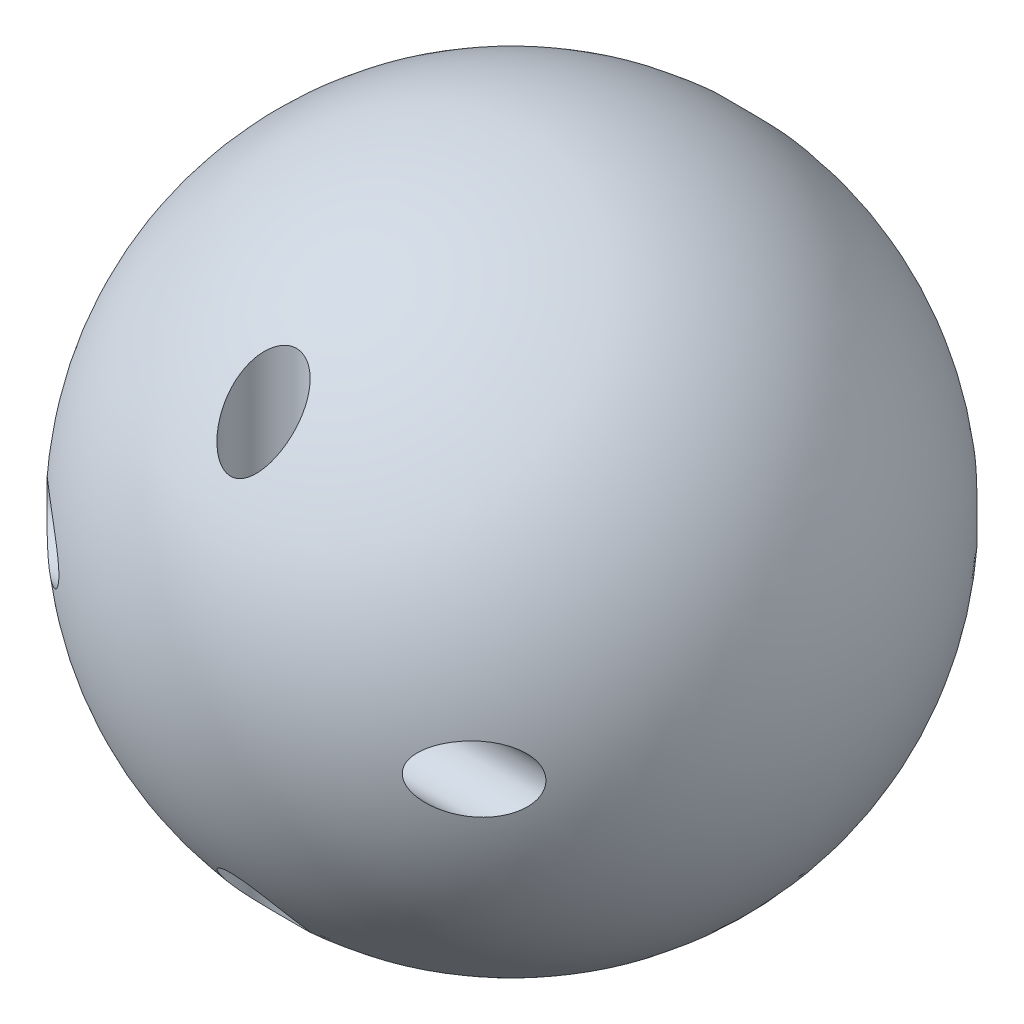
from build123d import *

# Parameters (mm, degrees)
CORTAR_EXTRUIR1_DEPTH        = 10
CORTAR_EXTRUIR1_DEPTH_BACK   = 11
CROQUIS3_R                   = 0.928145954
CORTAR_EXTRUIR2_DEPTH        = 11
CORTAR_EXTRUIR2_DEPTH_BACK   = 11
CROQUIS4_R                   = 0.928145954
SALIENTE_EXTRUIR1_DEPTH      = 8
SALIENTE_EXTRUIR1_DEPTH_BACK = 8
CROQUIS6_R                   = 2.748711599


with BuildPart() as part:
    # Croquis2 → Revolución3 (revolve)
    with BuildSketch(Plane.XY):
        with BuildLine():
            Line((0, 9.284703053), (0, -9.284703053))
            ThreePointArc((0, -9.284703053), (9.284703053, 0), (0, 9.284703053))
        make_face()
    revolve(axis=Axis((0, 0, 0), (0, 1, 0)))

    # Croquis3 → Cortar-Extruir1 (cut, two sides: drawn at the far end of the back side and taken through both)
    with BuildSketch(Plane(origin=(0, 0, 0), x_dir=(1, 0, 0), z_dir=(0, 1, 0)).offset(-CORTAR_EXTRUIR1_DEPTH_BACK)):
        with Locations((0, 6.997947923)):
            Circle(CROQUIS3_R)
        with Locations((0, -6.997947923)):
            Circle(CROQUIS3_R)
    extrude(amount=CORTAR_EXTRUIR1_DEPTH + CORTAR_EXTRUIR1_DEPTH_BACK, mode=Mode.SUBTRACT)

    # Croquis4 → Cortar-Extruir2 (cut, two sides: drawn at the far end of the back side and taken through both)
    with BuildSketch(Plane(origin=(0, 0, 0), x_dir=(0, 0, -1), z_dir=(1, 0, 0)).offset(-CORTAR_EXTRUIR2_DEPTH_BACK)):
        with Locations((6.997947923, 0)):
            Circle(CROQUIS4_R)
        with Locations((-6.997947923, 0)):
            Circle(CROQUIS4_R)
    extrude(amount=CORTAR_EXTRUIR2_DEPTH + CORTAR_EXTRUIR2_DEPTH_BACK, mode=Mode.SUBTRACT)

    # Croquis6 → Saliente-Extruir1 (add, two sides: drawn at the far end of the back side and taken through both)
    with BuildSketch(Plane.XY.offset(-SALIENTE_EXTRUIR1_DEPTH_BACK)):
        Circle(CROQUIS6_R)
    extrude(amount=SALIENTE_EXTRUIR1_DEPTH + SALIENTE_EXTRUIR1_DEPTH_BACK)


solid = part.part
